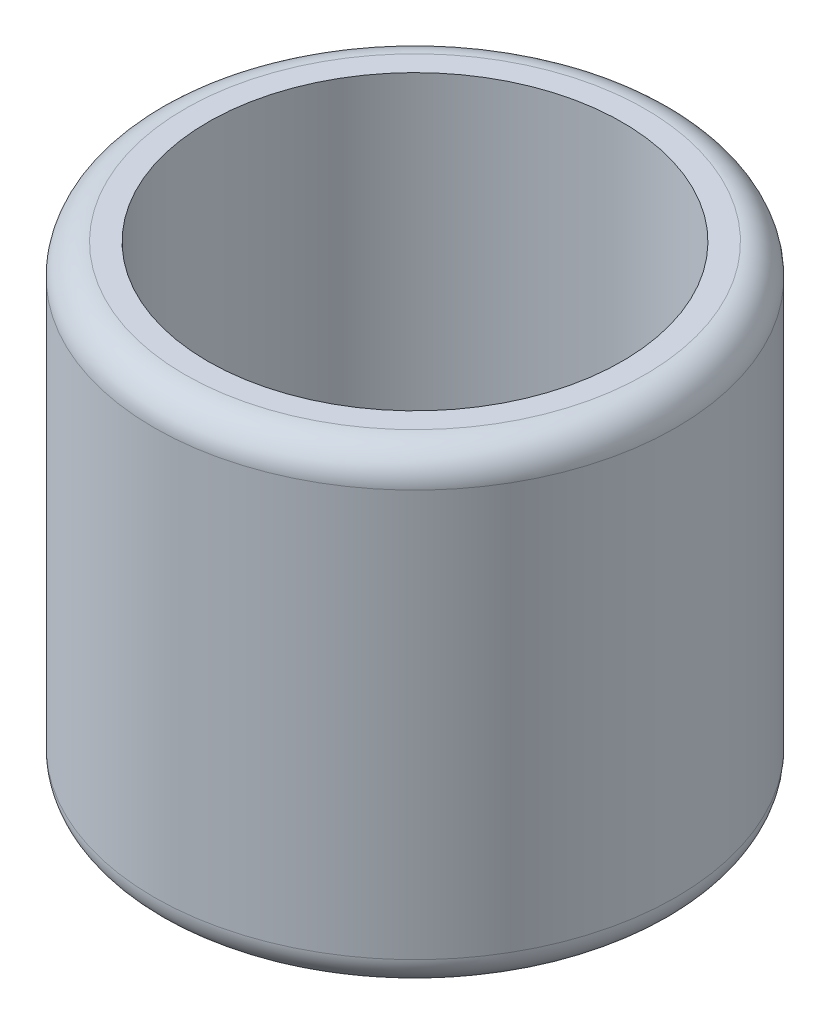
from build123d import *

# Parameters (mm, degrees)
SKETCH1_R           = 17
BOSS_EXTRUDE1_DEPTH = 4
SKETCH2_R           = 17
SKETCH2_R_2         = 13.5
BOSS_EXTRUDE2_DEPTH = 26.5
FILLET1_R           = 2


with BuildPart() as part:
    # Sketch1 → Boss-Extrude1 (new body)
    with BuildSketch(Plane(origin=(0, 0, 0), x_dir=(1, 0, 0), z_dir=(0, 1, 0))):
        with Locations(Location((0, 0, 0), (0, 0, 270))):
            Circle(SKETCH1_R)
    extrude(amount=BOSS_EXTRUDE1_DEPTH)

    # Sketch2 → Boss-Extrude2 (add)
    with BuildSketch(Plane(origin=(0, 4, 0), x_dir=(1, 0, 0), z_dir=(0, 1, 0))):
        with Locations(Location((0, 0, 0), (0, 0, 270))):
            Circle(SKETCH2_R)
        with Locations(Location((0, 0, 0), (0, 0, 270))):
            Circle(SKETCH2_R_2, mode=Mode.SUBTRACT)
    extrude(amount=BOSS_EXTRUDE2_DEPTH)

    # Fillet1
    fillet1_edges = [part.edges().sort_by_distance(p)[0] for p in [
        (0, 0, -17),
        (0, 30.5, -17),
    ]]
    fillet(fillet1_edges, radius=FILLET1_R)


solid = part.part
